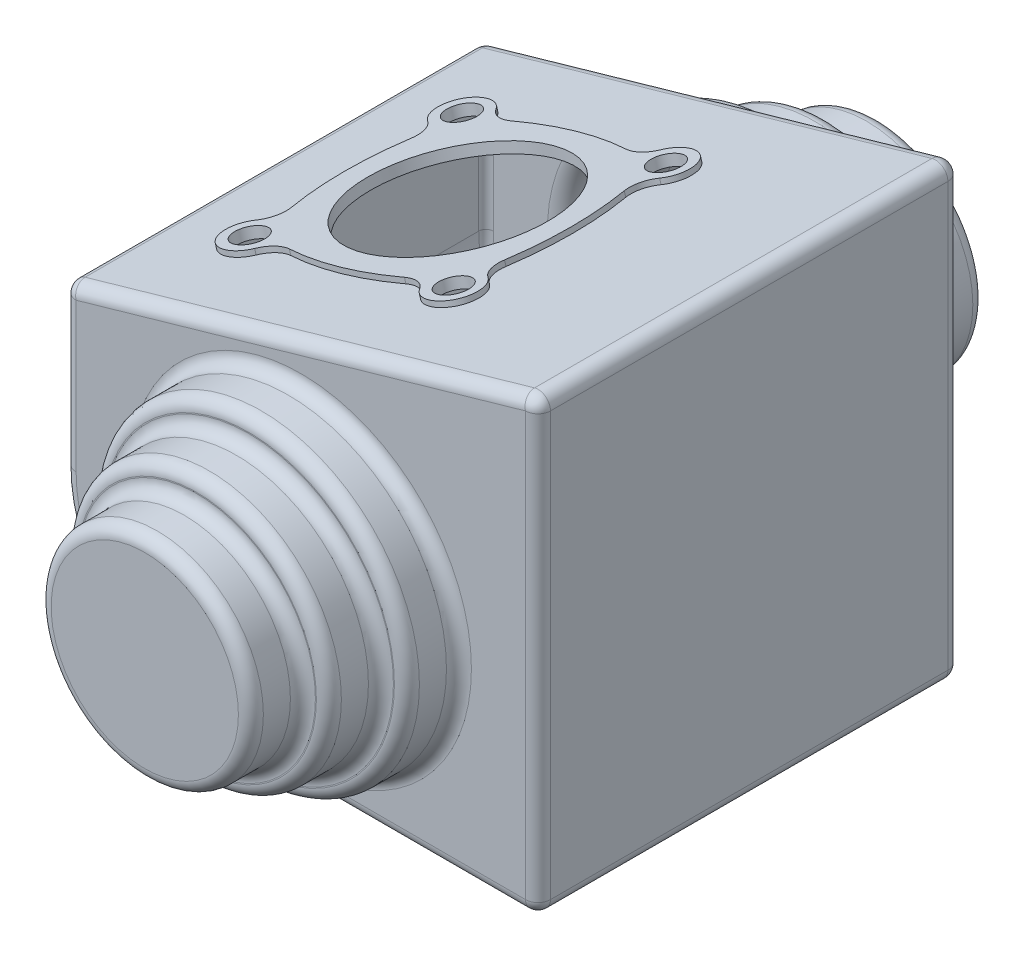
from build123d import *

# Parameters (mm, degrees)
BOSS_EXTRUDE1_DEPTH = 101.5
SKETCH4_R           = 76
BOSS_EXTRUDE3_DEPTH = 25
SKETCH4_4_R         = 63.5
BOSS_EXTRUDE4_DEPTH = 50
SKETCH4_5_R         = 51
BOSS_EXTRUDE5_DEPTH = 75
FILLET7_R           = 6
SHELL1_T            = 2.5
SKETCH5_R           = 45
SKETCH5_R_2         = 7.5
CUT_EXTRUDE1_DEPTH  = 10
BOSS_EXTRUDE6_START = 2.5
SKETCH5_4_R         = 45
SKETCH5_4_R_2       = 7.5
BOSS_EXTRUDE6_DEPTH = 2.5


with BuildPart() as part:
    # Sketch3 → Boss-Extrude1 (new, symmetric)
    with BuildSketch(Plane.XY):
        with BuildLine():
            Line((-38, -89), (114, -89))
            Line((114, -89), (114, 128.377947953))
            Line((114, 128.377947953), (-114, 63))
            Line((-114, 63), (-114, -13))
            ThreePointArc((-114, -13), (-91.74011537, -66.74011537), (-38, -89))
        make_face()
    extrude(amount=BOSS_EXTRUDE1_DEPTH, both=True)

    # Sketch4 → Boss-Extrude3 (add)
    with BuildSketch(Plane.XY.offset(101.5)):
        Circle(SKETCH4_R)
    boss_extrude3 = extrude(amount=BOSS_EXTRUDE3_DEPTH)

    # Sketch4<4> → Boss-Extrude4 (add)
    with BuildSketch(Plane.XY.offset(101.5)):
        Circle(SKETCH4_4_R)
    boss_extrude4 = extrude(amount=BOSS_EXTRUDE4_DEPTH)

    # Sketch4<5> → Boss-Extrude5 (add)
    with BuildSketch(Plane.XY.offset(101.5)):
        Circle(SKETCH4_5_R)
    boss_extrude5 = extrude(amount=BOSS_EXTRUDE5_DEPTH)

    # Mirror1: Boss-Extrude3, Boss-Extrude4, Boss-Extrude5 across plane
    add(boss_extrude3.mirror(Plane.XY))
    add(boss_extrude4.mirror(Plane.XY))
    add(boss_extrude5.mirror(Plane.XY))

    # Fillet7
    fillet7_edges = [part.edges().sort_by_distance(p)[0] for p in [
        (114, 19.688973977, 101.5),
        (-76, 0, 101.5),
        (0, 95.688973977, 101.5),
        (-76, 0, 126.5),
        (-114, 25, 101.5),
        (-63.5, 0, 126.5),
        (-63.5, 0, 151.5),
        (-51, 0, 151.5),
        (-51, 0, 176.5),
        (-76, 0, -126.5),
        (-76, 0, -101.5),
        (-63.5, 0, -126.5),
        (-63.5, 0, -151.5),
        (-51, 0, -151.5),
        (-51, 0, -176.5),
        (-91.74011537, -66.74011537, 101.5),
        (-114, 25, -101.5),
        (0, 95.688973977, -101.5),
        (114, 19.688973977, -101.5),
        (38, -89, -101.5),
        (-91.74011537, -66.74011537, -101.5),
        (38, -89, 101.5),
        (-114, 63, 0),
        (114, 128.377947953, 0),
        (114, -89, 0),
    ]]
    fillet(fillet7_edges, radius=FILLET7_R)

    # Shell1 (no face opened: a closed hollow body)
    add(offset(amount=-SHELL1_T, mode=Mode.PRIVATE), mode=Mode.SUBTRACT)

    # Sketch5 → Cut-Extrude1 (cut)
    with BuildSketch(Plane(origin=(-25.353715342, 88.41891309, 0), x_dir=(0.9612616959383197, 0.2756373558169965, 0), z_dir=(-0.27563735581699655, 0.9612616959383198, 0))):
        with Locations(Location((0, 0, 0), (0, 0, 180))):
            Circle(SKETCH5_R)
        with Locations(Location((-51, 51, 0), (0, 0, 180))):
            Circle(SKETCH5_R_2)
        with Locations(Location((51, 51, 0), (0, 0, 180))):
            Circle(SKETCH5_R_2)
        with Locations(Location((51, -51, 0), (0, 0, 180))):
            Circle(SKETCH5_R_2)
        with Locations(Location((-51, -51, 0), (0, 0, 180))):
            Circle(SKETCH5_R_2)
    extrude(amount=-CUT_EXTRUDE1_DEPTH, mode=Mode.SUBTRACT)

    # Sketch5<4> → Boss-Extrude6 (add)
    with BuildSketch(Plane(origin=(-25.353715342, 88.41891309, 0), x_dir=(0.9612616959383197, 0.2756373558169965, 0), z_dir=(-0.27563735581699655, 0.9612616959383198, 0)).offset(BOSS_EXTRUDE6_START)):
        with BuildLine():
            ThreePointArc((57.99553429, 41.25), (59.485281374, 59.485281374), (41.25, 57.99553429))
            ThreePointArc((41.25, 57.99553429), (35.726297869, 53.759933004), (28.78057554, 53.303265937))
            ThreePointArc((28.78057554, 53.303265937), (0, 56.60735464), (-28.78057554, 53.303265937))
            ThreePointArc((-28.78057554, 53.303265937), (-35.726297869, 53.759933004), (-41.25, 57.99553429))
            ThreePointArc((-41.25, 57.99553429), (-59.485281374, 59.485281374), (-57.99553429, 41.25))
            ThreePointArc((-57.99553429, 41.25), (-53.759933004, 35.726297869), (-53.303265937, 28.78057554))
            ThreePointArc((-53.303265937, 28.78057554), (-56.60735464, 0), (-53.303265937, -28.78057554))
            ThreePointArc((-53.303265937, -28.78057554), (-53.759933004, -35.726297869), (-57.99553429, -41.25))
            ThreePointArc((-57.99553429, -41.25), (-59.485281374, -59.485281374), (-41.25, -57.99553429))
            ThreePointArc((-41.25, -57.99553429), (-35.726297869, -53.759933004), (-28.78057554, -53.303265937))
            ThreePointArc((-28.78057554, -53.303265937), (0, -56.60735464), (28.78057554, -53.303265937))
            ThreePointArc((28.78057554, -53.303265937), (35.726297869, -53.759933004), (41.25, -57.99553429))
            ThreePointArc((41.25, -57.99553429), (59.485281374, -59.485281374), (57.99553429, -41.25))
            ThreePointArc((57.99553429, -41.25), (53.759933004, -35.726297869), (53.303265937, -28.78057554))
            ThreePointArc((53.303265937, -28.78057554), (56.60735464, 0), (53.303265937, 28.78057554))
            ThreePointArc((53.303265937, 28.78057554), (53.759933004, 35.726297869), (57.99553429, 41.25))
        make_face()
        with Locations(Location((0, 0, 0), (0, 0, 180))):
            Circle(SKETCH5_4_R, mode=Mode.SUBTRACT)
        with Locations(Location((-51, 51, 0), (0, 0, 180))):
            Circle(SKETCH5_4_R_2, mode=Mode.SUBTRACT)
        with Locations(Location((51, 51, 0), (0, 0, 180))):
            Circle(SKETCH5_4_R_2, mode=Mode.SUBTRACT)
        with Locations(Location((51, -51, 0), (0, 0, 180))):
            Circle(SKETCH5_4_R_2, mode=Mode.SUBTRACT)
        with Locations(Location((-51, -51, 0), (0, 0, 180))):
            Circle(SKETCH5_4_R_2, mode=Mode.SUBTRACT)
    extrude(amount=-BOSS_EXTRUDE6_DEPTH)


solid = part.part
